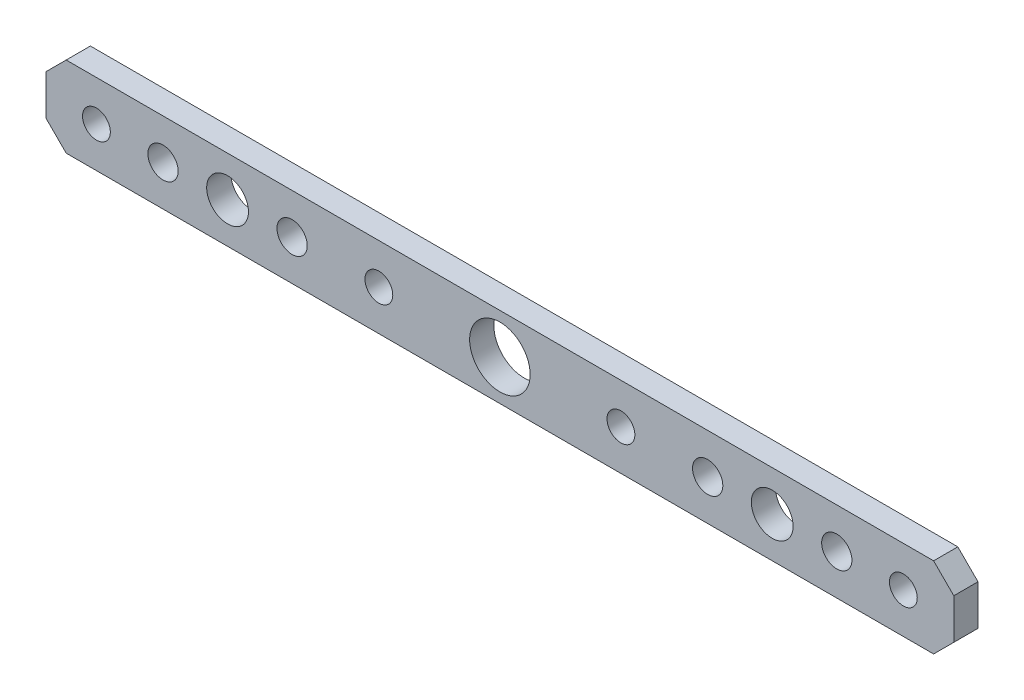
from build123d import *

# Parameters (mm, degrees)
SKETCH1_W           = 225
SKETCH1_H           = 20
SKETCH1_R           = 3.75
SKETCH1_R_2         = 5.177315147
SKETCH1_R_3         = 5.175
SKETCH1_R_4         = 3.445800431
SKETCH1_R_5         = 7.5
BOSS_EXTRUDE1_DEPTH = 6
CHAMFER1_SIZE       = 5


with BuildPart() as part:
    # Sketch1 → Boss-Extrude1 (new body)
    with BuildSketch(Plane.XY):
        with Locations((0.517233183, -19.612075113)):
            Rectangle(SKETCH1_W, SKETCH1_H)
        with Locations((84.017233183, -19.612075113)):
            Circle(SKETCH1_R, mode=Mode.SUBTRACT)
        with Locations((52.017233183, -19.612075113)):
            Circle(SKETCH1_R, mode=Mode.SUBTRACT)
        with Locations((68.017233183, -19.612075113)):
            Circle(SKETCH1_R_2, mode=Mode.SUBTRACT)
        with Locations((-50.982766817, -19.612075113)):
            Circle(SKETCH1_R, mode=Mode.SUBTRACT)
        with Locations((-82.982766817, -19.612075113)):
            Circle(SKETCH1_R, mode=Mode.SUBTRACT)
        with Locations((-66.982766817, -19.612075113)):
            Circle(SKETCH1_R_3, mode=Mode.SUBTRACT)
        with Locations((30.517233183, -19.612075113)):
            Circle(SKETCH1_R_4, mode=Mode.SUBTRACT)
        with Locations((-29.482766817, -19.612075113)):
            Circle(SKETCH1_R_4, mode=Mode.SUBTRACT)
        with Locations((100.517233183, -19.612075113)):
            Circle(SKETCH1_R_4, mode=Mode.SUBTRACT)
        with Locations((-99.482766817, -19.612075113)):
            Circle(SKETCH1_R_4, mode=Mode.SUBTRACT)
        with Locations((0.517233183, -19.612075113)):
            Circle(SKETCH1_R_5, mode=Mode.SUBTRACT)
    extrude(amount=BOSS_EXTRUDE1_DEPTH)

    # Chamfer1
    chamfer1_edges = [part.edges().sort_by_distance(p)[0] for p in [
        (-111.982766817, -9.612075113, 3),
        (113.017233183, -9.612075113, 3),
        (113.017233183, -29.612075113, 3),
        (-111.982766817, -29.612075113, 3),
    ]]
    chamfer(chamfer1_edges, length=CHAMFER1_SIZE)


solid = part.part
